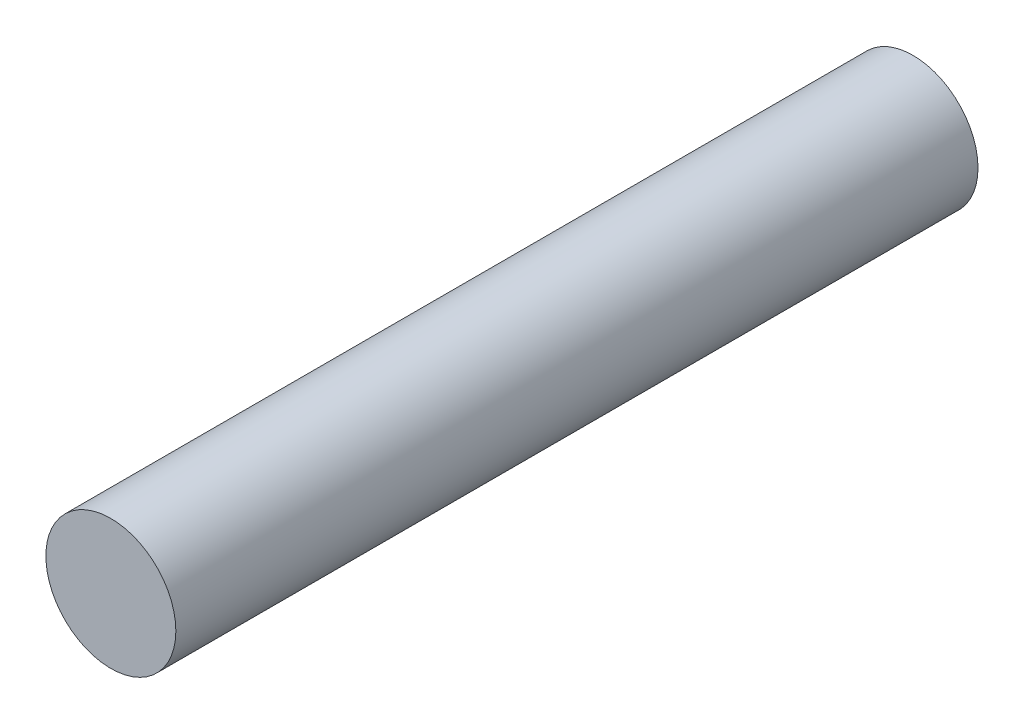
from build123d import *

# Parameters (mm, degrees)
SKETCH1_R           = 0.175
BOSS_EXTRUDE1_DEPTH = 2.16


with BuildPart() as part:
    # Sketch1 → Boss-Extrude1 (new body)
    with BuildSketch(Plane.XY):
        Circle(SKETCH1_R)
    extrude(amount=BOSS_EXTRUDE1_DEPTH)


solid = part.part
